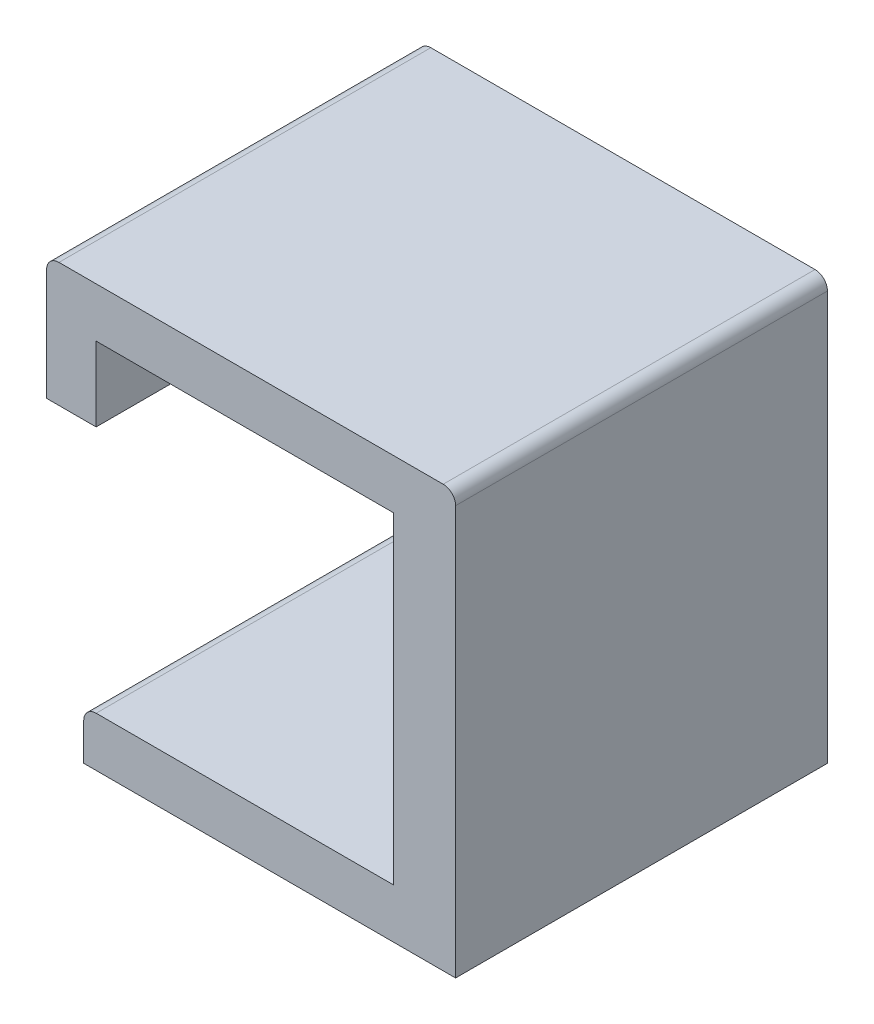
from build123d import *

# Parameters (mm, degrees)
SKETCH1_W           = 30
SKETCH1_H           = 30
BOSS_EXTRUDE1_DEPTH = 4
SKETCH2_W           = 5
SKETCH2_H           = 30
BOSS_EXTRUDE2_DEPTH = 30
SKETCH3_W           = 30
SKETCH3_H           = 4
BOSS_EXTRUDE3_DEPTH = 28
SKETCH4_W           = 4
SKETCH4_H           = 30
BOSS_EXTRUDE4_DEPTH = 6
FILLET1_R           = 1


with BuildPart() as part:
    # Sketch1 → Boss-Extrude1 (new body)
    with BuildSketch(Plane(origin=(0, 0, 0), x_dir=(1, 0, 0), z_dir=(0, 1, 0))):
        with Locations((15, 15)):
            Rectangle(SKETCH1_W, SKETCH1_H)
    extrude(amount=BOSS_EXTRUDE1_DEPTH)

    # Sketch2 → Boss-Extrude2 (add)
    with BuildSketch(Plane(origin=(0, 4, 0), x_dir=(1, 0, 0), z_dir=(0, 1, 0))):
        with Locations((27.5, 15)):
            Rectangle(SKETCH2_W, SKETCH2_H)
    extrude(amount=BOSS_EXTRUDE2_DEPTH)

    # Sketch3 → Boss-Extrude3 (add)
    with BuildSketch(Plane.ZY.offset(-25)):
        with Locations((-15, 32)):
            Rectangle(SKETCH3_W, SKETCH3_H)
    extrude(amount=BOSS_EXTRUDE3_DEPTH)

    # Sketch4 → Boss-Extrude4 (add)
    with BuildSketch(Plane.XZ.offset(-30)):
        with Locations((-1, -15)):
            Rectangle(SKETCH4_W, SKETCH4_H)
    extrude(amount=BOSS_EXTRUDE4_DEPTH)

    # Fillet1
    fillet1_edges = [part.edges().sort_by_distance(p)[0] for p in [
        (0, 4, -15),
        (30, 34, -15),
        (-3, 34, -15),
    ]]
    fillet(fillet1_edges, radius=FILLET1_R)


solid = part.part
